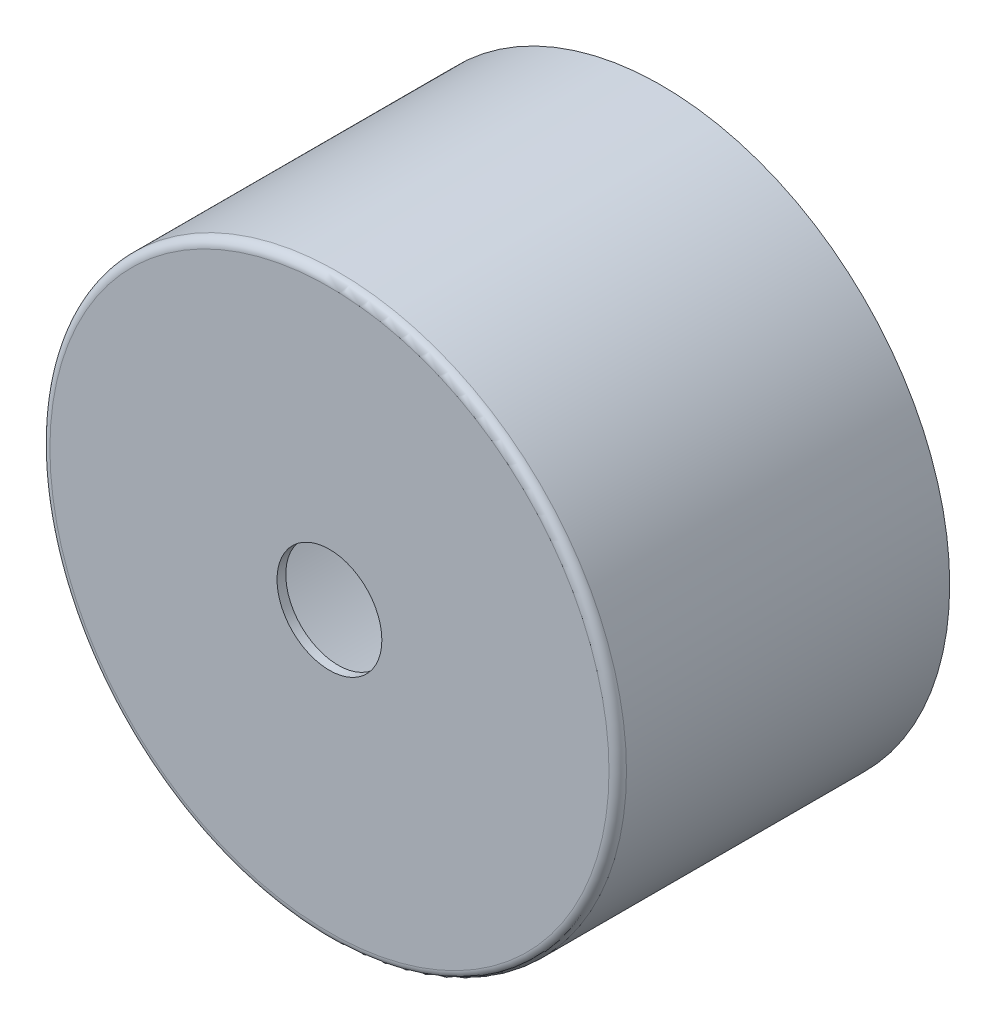
from build123d import *

# Parameters (mm, degrees)
SKETCH1_R           = 16.5
BOSS_EXTRUDE1_DEPTH = 19
SHELL1_T            = -0.5
SKETCH2_R           = 3
CUT_EXTRUDE1_DEPTH  = 31.091527047
FILLET1_R           = 0.5


with BuildPart() as part:
    # Sketch1 → Boss-Extrude1 (new body)
    with BuildSketch(Plane.XY):
        Circle(SKETCH1_R)
    extrude(amount=-BOSS_EXTRUDE1_DEPTH)

    # Shell1
    shell1_openings = [part.faces().sort_by_distance(p)[0] for p in [
        (0, 0, -19),
    ]]
    offset(amount=SHELL1_T, openings=shell1_openings, kind=Kind.INTERSECTION)

    # Sketch2 → Cut-Extrude1 (cut, through all)
    with BuildSketch(Plane.XY):
        Circle(SKETCH2_R)
    extrude(amount=-CUT_EXTRUDE1_DEPTH, mode=Mode.SUBTRACT)

    # Fillet1
    fillet1_edges = [part.edges().sort_by_distance(p)[0] for p in [
        (-16.5, 0, 0),
    ]]
    fillet(fillet1_edges, radius=FILLET1_R)


solid = part.part
